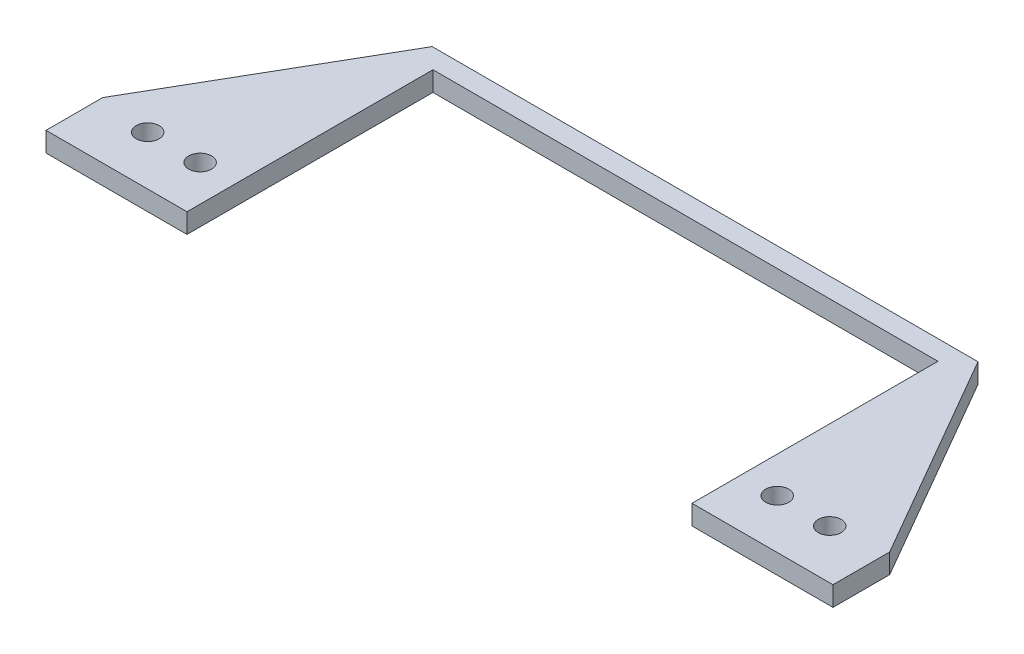
from build123d import *

# Parameters (mm, degrees)
BOSS_EXTRUDE1_DEPTH = 3
SKETCH2_R           = 1.75
CUT_EXTRUDE1_DEPTH  = 65.356450115


with BuildPart() as part:
    # Sketch1 → Boss-Extrude1 (new body)
    with BuildSketch(Plane(origin=(0, 0, 0), x_dir=(1, 0, 0), z_dir=(0, 1, 0))):
        Polygon((-41.611393926, 23.081435644), (41.611393926, 23.081435644), (60, -8.768564356), (60, -17.418564356), (38.5, -17.418564356), (38.5, 20.081435644), (-38.5, 20.081435644), (-38.5, -17.418564356), (-60, -17.418564356), (-60, -8.768564356), align=None)
    extrude(amount=BOSS_EXTRUDE1_DEPTH)

    # Sketch2 → Cut-Extrude1 (cut, through all)
    with BuildSketch(Plane(origin=(0, 3, 0), x_dir=(1, 0, 0), z_dir=(0, 1, 0))):
        with Locations(Location((52, -9.918564356, 0), (0, 0, 270))):
            Circle(SKETCH2_R)
        with Locations(Location((44, -9.918564356, 0), (0, 0, 270))):
            Circle(SKETCH2_R)
        with Locations(Location((-52, -9.918564356, 0), (0, 0, 90))):
            Circle(SKETCH2_R)
        with Locations(Location((-44, -9.918564356, 0), (0, 0, 90))):
            Circle(SKETCH2_R)
    extrude(amount=-CUT_EXTRUDE1_DEPTH, mode=Mode.SUBTRACT)


solid = part.part
